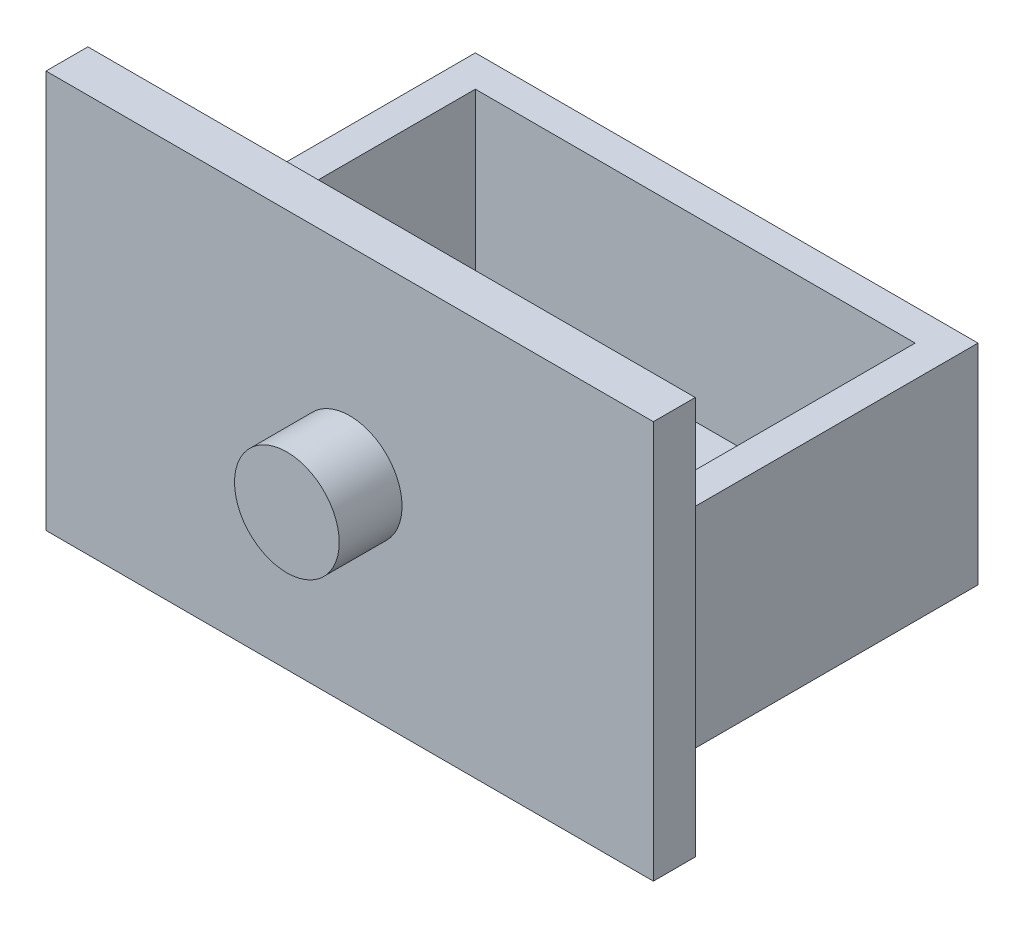
from build123d import *

# Parameters (mm, degrees)
SKETCH_2_W          = 29
SKETCH_2_H          = 19
EXTRUDE_1_DEPTH     = 2
SKETCH_3_W          = 24
SKETCH_3_H          = 10
EXTRUDE_2_DEPTH     = 16
SKETCH_4_W          = 21
SKETCH_4_H          = 13
CUT_EXTRUDE_1_DEPTH = 8.5
SKETCH_5_R          = 2.5
EXTRUDE_3_DEPTH     = 3


with BuildPart() as part:
    # 草图2 → 凸台-拉伸1 (new body)
    with BuildSketch(Plane.XY):
        Rectangle(SKETCH_2_W, SKETCH_2_H)
    extrude(amount=EXTRUDE_1_DEPTH)

    # 草图3 → 凸台-拉伸2 (add)
    with BuildSketch(Plane(origin=(0, 0, 0), x_dir=(-1, 0, 0), z_dir=(0, 0, -1))):
        with Locations((0, -2.5)):
            Rectangle(SKETCH_3_W, SKETCH_3_H)
    extrude(amount=EXTRUDE_2_DEPTH)

    # 草图4 → 切除-拉伸1 (cut)
    with BuildSketch(Plane(origin=(0, 2.5, 0), x_dir=(1, 0, 0), z_dir=(0, 1, 0))):
        with Locations((0, 8)):
            Rectangle(SKETCH_4_W, SKETCH_4_H)
    extrude(amount=-CUT_EXTRUDE_1_DEPTH, mode=Mode.SUBTRACT)

    # 草图5 → 凸台-拉伸3 (add)
    with BuildSketch(Plane.XY.offset(2)):
        with Locations(Location((0, 0, 0), (0, 0, 180))):
            Circle(SKETCH_5_R)
    extrude(amount=EXTRUDE_3_DEPTH)


solid = part.part
